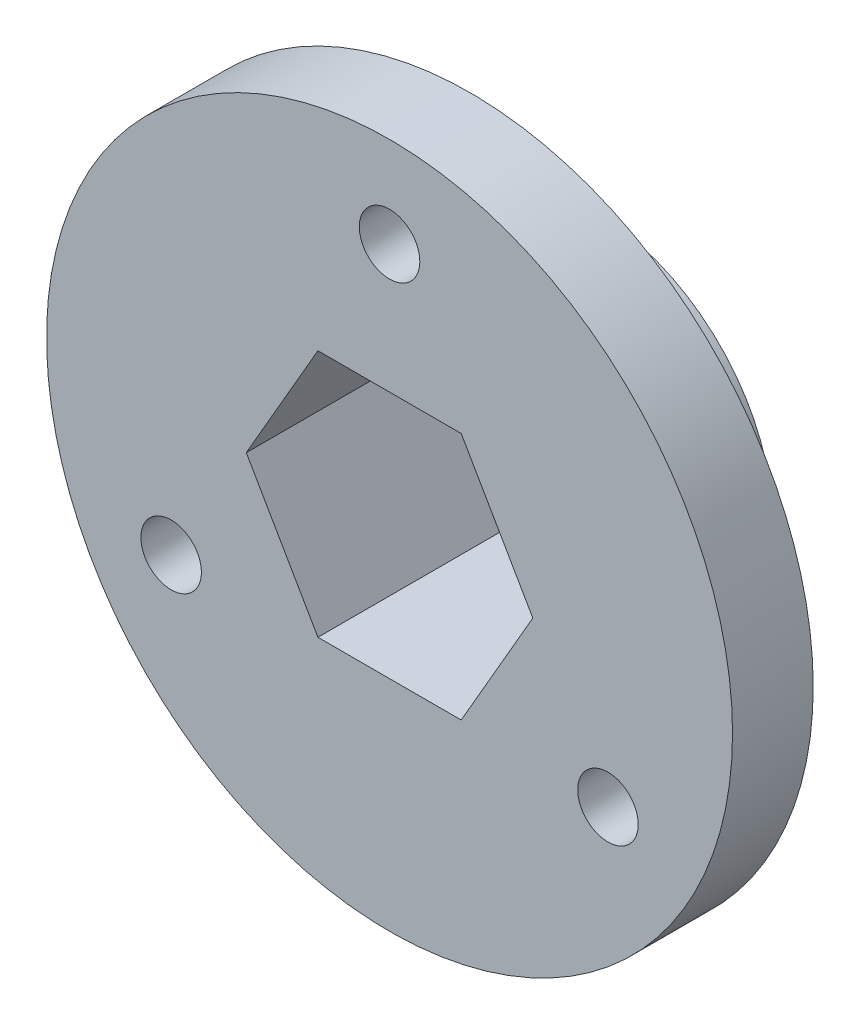
from build123d import *

# Parameters (mm, degrees)
CROQUIS1_R              = 17
CROQUIS1_R_2            = 1.5
SALIENTE_EXTRUIR1_DEPTH = 4
CORTAR_EXTRUIR1_DEPTH   = 4
SALIENTE_EXTRUIR2_START = 6
CROQUIS3_R              = 9
CROQUIS3_R_2            = 1.5
SALIENTE_EXTRUIR2_DEPTH = 6


with BuildPart() as part:
    # Croquis1 → Saliente-Extruir1 (new body)
    with BuildSketch(Plane.XY):
        Circle(CROQUIS1_R)
        with Locations((0, 12.5)):
            Circle(CROQUIS1_R_2, mode=Mode.SUBTRACT)
        with Locations((10.825317547, -6.25)):
            Circle(CROQUIS1_R_2, mode=Mode.SUBTRACT)
        with Locations((-10.825317547, -6.25)):
            Circle(CROQUIS1_R_2, mode=Mode.SUBTRACT)
    extrude(amount=SALIENTE_EXTRUIR1_DEPTH)

    # Croquis2 → Cortar-Extruir1 (cut)
    with BuildSketch(Plane(origin=(0, 0, 0), x_dir=(-1, 0, 0), z_dir=(0, 0, -1))):
        Polygon((3.550704156, 6.15), (-3.550704156, 6.15), (-7.101408311, 0), (-3.550704156, -6.15), (3.550704156, -6.15), (7.101408311, 0), align=None)
    extrude(amount=-CORTAR_EXTRUIR1_DEPTH, mode=Mode.SUBTRACT)

    # Croquis3 → Saliente-Extruir2 (add)
    # profile 1 of 4: a face of its own
    with BuildSketch(Plane(origin=(0, 0, 0), x_dir=(-1, 0, 0), z_dir=(0, 0, -1)).offset(SALIENTE_EXTRUIR2_START)):
        Circle(CROQUIS3_R)
        Polygon((-7.101408311, 0), (-3.550704156, 6.15), (3.550704156, 6.15), (7.101408311, 0), (3.550704156, -6.15), (-3.550704156, -6.15), align=None, mode=Mode.SUBTRACT)
    # profile 2 of 4: a face of its own
    with BuildSketch(Plane(origin=(0, 0, 0), x_dir=(-1, 0, 0), z_dir=(0, 0, -1)).offset(SALIENTE_EXTRUIR2_START)):
        with Locations(Location((0, 12.5, 0), (0, 0, 180))):
            Circle(CROQUIS3_R_2)
    # profile 3 of 4: a face of its own
    with BuildSketch(Plane(origin=(0, 0, 0), x_dir=(-1, 0, 0), z_dir=(0, 0, -1)).offset(SALIENTE_EXTRUIR2_START)):
        with Locations(Location((-10.825317547, -6.25, 0), (0, 0, 180))):
            Circle(CROQUIS3_R_2)
    # profile 4 of 4: a face of its own
    with BuildSketch(Plane(origin=(0, 0, 0), x_dir=(-1, 0, 0), z_dir=(0, 0, -1)).offset(SALIENTE_EXTRUIR2_START)):
        with Locations(Location((10.825317547, -6.25, 0), (0, 0, 180))):
            Circle(CROQUIS3_R_2)
    extrude(amount=-SALIENTE_EXTRUIR2_DEPTH)


with BuildPart() as saliente_extruir2_kept_piece:
    # of the separate pieces the step leaves, the one the design keeps (saliente_extruir2_pieces_kept)
    add(part.part.solids().sort_by_distance((17, 0, 0))[0])


solid = saliente_extruir2_kept_piece.part
